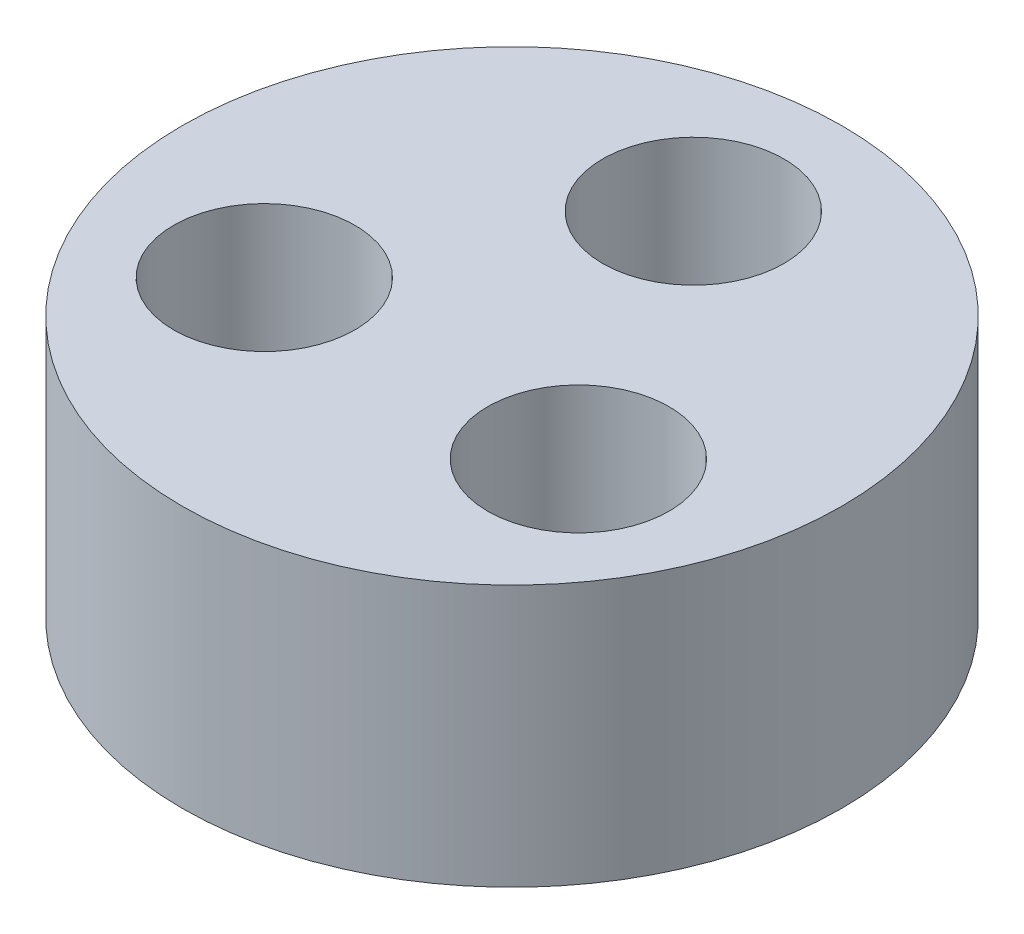
from build123d import *

# Parameters (mm, degrees)
SKETCH1_R           = 4
SKETCH1_R_2         = 1.1
BOSS_EXTRUDE1_DEPTH = 3.175


with BuildPart() as part:
    # Sketch1 → Boss-Extrude1 (new body)
    with BuildSketch(Plane(origin=(0, 0, 0), x_dir=(1, 0, 0), z_dir=(0, 1, 0))):
        with Locations(Location((0, 0, 0), (0, 0, 270))):
            Circle(SKETCH1_R)
        with Locations(Location((0, 2.2, 0), (0, 0, 270))):
            Circle(SKETCH1_R_2, mode=Mode.SUBTRACT)
        with Locations(Location((1.905255888, -1.1, 0), (0, 0, 270))):
            Circle(SKETCH1_R_2, mode=Mode.SUBTRACT)
        with Locations(Location((-1.905255888, -1.1, 0), (0, 0, 270))):
            Circle(SKETCH1_R_2, mode=Mode.SUBTRACT)
    extrude(amount=BOSS_EXTRUDE1_DEPTH)


solid = part.part
